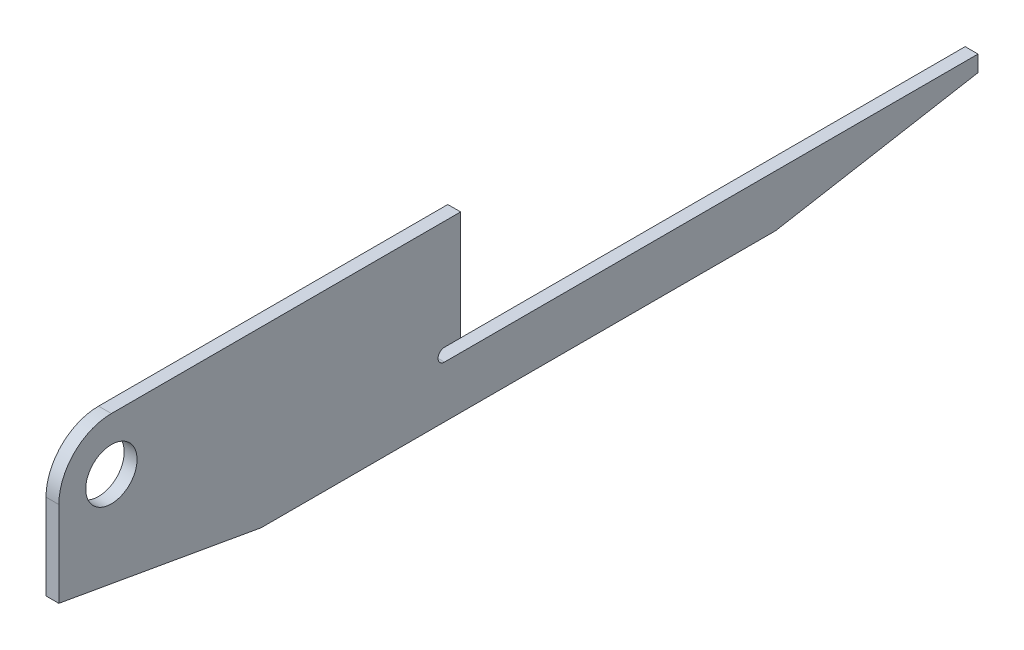
from build123d import *

# Parameters (mm, degrees)
SKETCH1_R           = 3.175
BOSS_EXTRUDE1_DEPTH = 0.79375


with BuildPart() as part:
    # Sketch1 → Boss-Extrude1 (new, symmetric)
    with BuildSketch(Plane.YZ):
        with BuildLine():
            Line((-138.9, 0), (-138.9, -43.2))
            Line((-138.9, -43.2), (-152.4, -43.2))
            Line((-152.4, -43.2), (-152.4, -41.2))
            ThreePointArc((-152.4, -41.2), (-153.19375, -40.40625), (-153.9875, -41.2))
            Line((-153.9875, -41.2), (-153.9875, -107.2))
            Line((-153.9875, -107.2), (-155.9875, -107.2))
            Line((-155.9875, -107.2), (-160.4, -82.175468971))
            Line((-160.4, -82.175468971), (-160.4, -18.524531029))
            Line((-160.4, -18.524531029), (-155.9875, 6.5))
            Line((-155.9875, 6.5), (-145.4, 6.5))
            ThreePointArc((-145.4, 6.5), (-140.803805922, 4.596194078), (-138.9, 0))
        make_face()
        with Locations(Location((-145.4, 0, 0), (0, 0, 270))):
            Circle(SKETCH1_R, mode=Mode.SUBTRACT)
    extrude(amount=BOSS_EXTRUDE1_DEPTH, both=True)


solid = part.part
